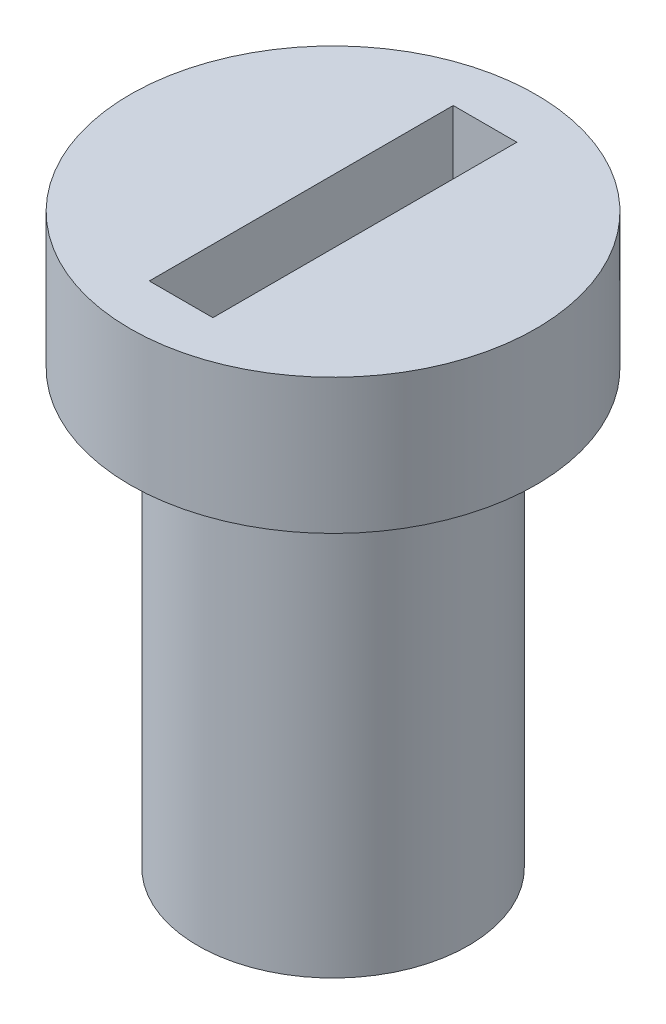
from build123d import *

# Parameters (mm, degrees)
SKETCH_1_R          = 7.5
EXTRUDE_1_DEPTH     = 5
SKETCH_2_R          = 5
EXTRUDE_2_DEPTH     = 16
SKETCH_3_W          = 2.35099294
SKETCH_3_H          = 11.234175126
CUT_EXTRUDE_1_DEPTH = 3


with BuildPart() as part:
    # 草图1 → 凸台-拉伸1 (new body)
    with BuildSketch(Plane(origin=(0, 0, 0), x_dir=(1, 0, 0), z_dir=(0, 1, 0))):
        with Locations(Location((0, 0, 0), (0, 0, 270))):
            Circle(SKETCH_1_R)
    extrude(amount=EXTRUDE_1_DEPTH)

    # 草图2 → 凸台-拉伸2 (add)
    with BuildSketch(Plane(origin=(0, 0, 0), x_dir=(-1, 0, 0), z_dir=(0, -1, 0))):
        with Locations(Location((0, 0, 0), (0, 0, 90))):
            Circle(SKETCH_2_R)
    extrude(amount=EXTRUDE_2_DEPTH)

    # 草图3 → 切除-拉伸1 (cut)
    with BuildSketch(Plane(origin=(0, 5, 0), x_dir=(1, 0, 0), z_dir=(0, 1, 0))):
        Rectangle(SKETCH_3_W, SKETCH_3_H)
    extrude(amount=-CUT_EXTRUDE_1_DEPTH, mode=Mode.SUBTRACT)


solid = part.part
